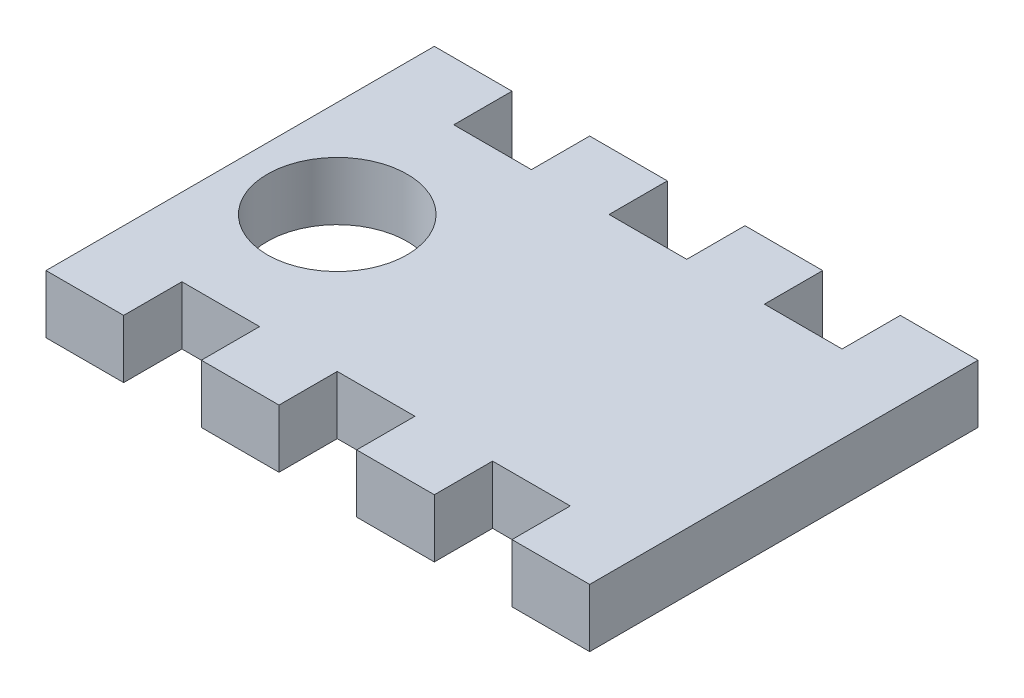
from build123d import *

# Parameters (mm, degrees)
CROQUIS1_R              = 3.6
SALIENTE_EXTRUIR3_DEPTH = 3


with BuildPart() as part:
    # Croquis1 → Saliente-Extruir3 (new body)
    with BuildSketch(Plane(origin=(0, 0, 0), x_dir=(1, 0, 0), z_dir=(0, 1, 0))):
        Polygon((-14, -10), (-10, -10), (-10, -7), (-6, -7), (-6, -10), (-2, -10), (-2, -7), (2, -7), (2, -10), (6, -10), (6, -7), (10, -7), (10, -10), (14, -10), (14, 10), (10, 10), (10, 7), (6, 7), (6, 10), (2, 10), (2, 7), (-2, 7), (-2, 10), (-6, 10), (-6, 7), (-10, 7), (-10, 10), (-14, 10), align=None)
        with Locations(Location((-9, 0, 0), (0, 0, 270))):
            Circle(CROQUIS1_R, mode=Mode.SUBTRACT)
    extrude(amount=SALIENTE_EXTRUIR3_DEPTH)


solid = part.part
